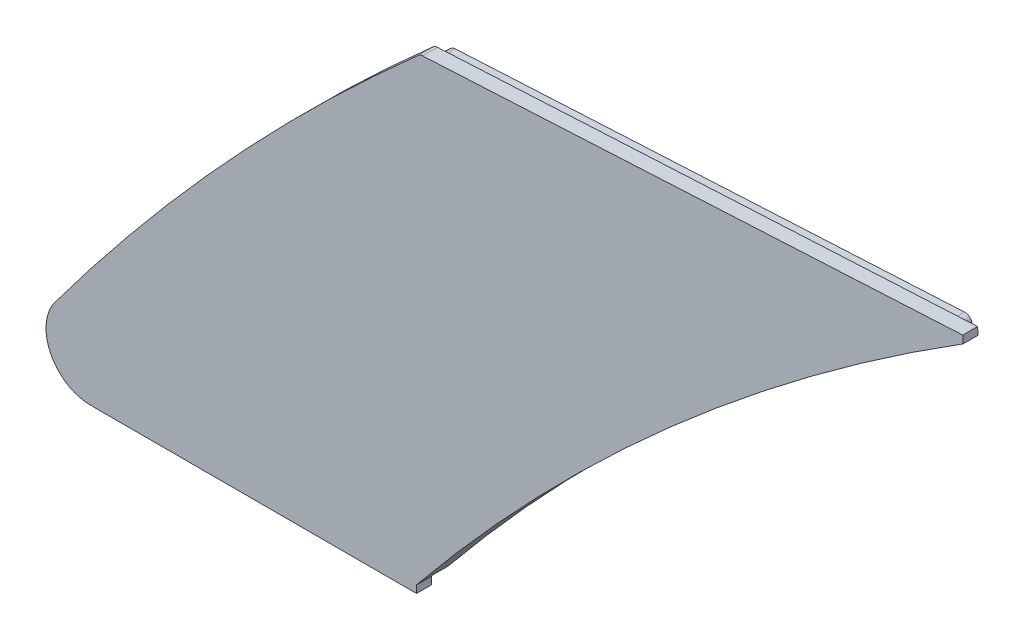
from build123d import *

# Parameters (mm, degrees)
BOSS_EXTRUDE1_DEPTH = 2
BOSS_EXTRUDE2_START = 2
BOSS_EXTRUDE2_DEPTH = 2


with BuildPart() as part:
    # Sketch2 → Boss-Extrude1 (new body)
    with BuildSketch(Plane.XY.offset(4)):
        with BuildLine():
            Line((-44.305483114, -62), (-0.949182939, -62))
            ThreePointArc((-0.949182939, -62), (-0.521138453, -61.903757665), (-0.175485968, -61.633555836))
            ThreePointArc((-0.175485968, -61.633555836), (32.378563383, -27.679914383), (69.824948938, 0.787331812))
            ThreePointArc((69.824948938, 0.787331812), (70.23551024, 1.935299571), (69.231475595, 2.626895546))
            Line((69.231475595, 2.626895546), (0.749958934, -0.962068664))
            ThreePointArc((0.749958934, -0.962068664), (0.423121019, -1.035372755), (0.13882509, -1.212495134))
            ThreePointArc((0.13882509, -1.212495134), (-25.448078904, -26.366894393), (-48.317042245, -54.015474353))
            ThreePointArc((-48.317042245, -54.015474353), (-48.773291762, -59.244701736), (-44.305483114, -62))
        make_face()
        with BuildLine():
            Line((69.283811551, 1.628266012), (0.80229489, -1.960698198))
            ThreePointArc((0.80229489, -1.960698198), (-24.711294193, -27.043021815), (-47.514730419, -54.612379482))
            ThreePointArc((-47.514730419, -54.612379482), (-47.879730032, -58.795761389), (-44.305483114, -61))
            Line((-44.305483114, -61), (-0.949182939, -61))
            ThreePointArc((-0.949182939, -61), (31.7130194, -26.933555752), (69.283811551, 1.628266012))
        make_face(mode=Mode.SUBTRACT)
    extrude(amount=-BOSS_EXTRUDE1_DEPTH)

    # Sketch3 → Boss-Extrude2 (add)
    with BuildSketch(Plane.XY.offset(4).offset(BOSS_EXTRUDE2_START)):
        with BuildLine():
            Line((73.03813327, 2.826394022), (72.985797314, 3.825023556))
            Line((72.985797314, 3.825023556), (0.348531139, 0.018265743))
            ThreePointArc((0.348531139, 0.018265743), (0.022157357, -0.054848295), (-0.261851868, -0.231495595))
            ThreePointArc((-0.261851868, -0.231495595), (-26.066145165, -25.561463063), (-49.119354071, -53.418569223))
            ThreePointArc((-49.119354071, -53.418569223), (-49.666853492, -59.693642083), (-44.305483114, -63))
            Line((-44.305483114, -63), (-0.475074433, -63))
            Line((-0.475074433, -63), (-0.475074433, -62))
            ThreePointArc((-0.475074433, -62), (33.625159473, -26.574476321), (73.03813327, 2.826394022))
        make_face()
    extrude(amount=-BOSS_EXTRUDE2_DEPTH)


solid = part.part
